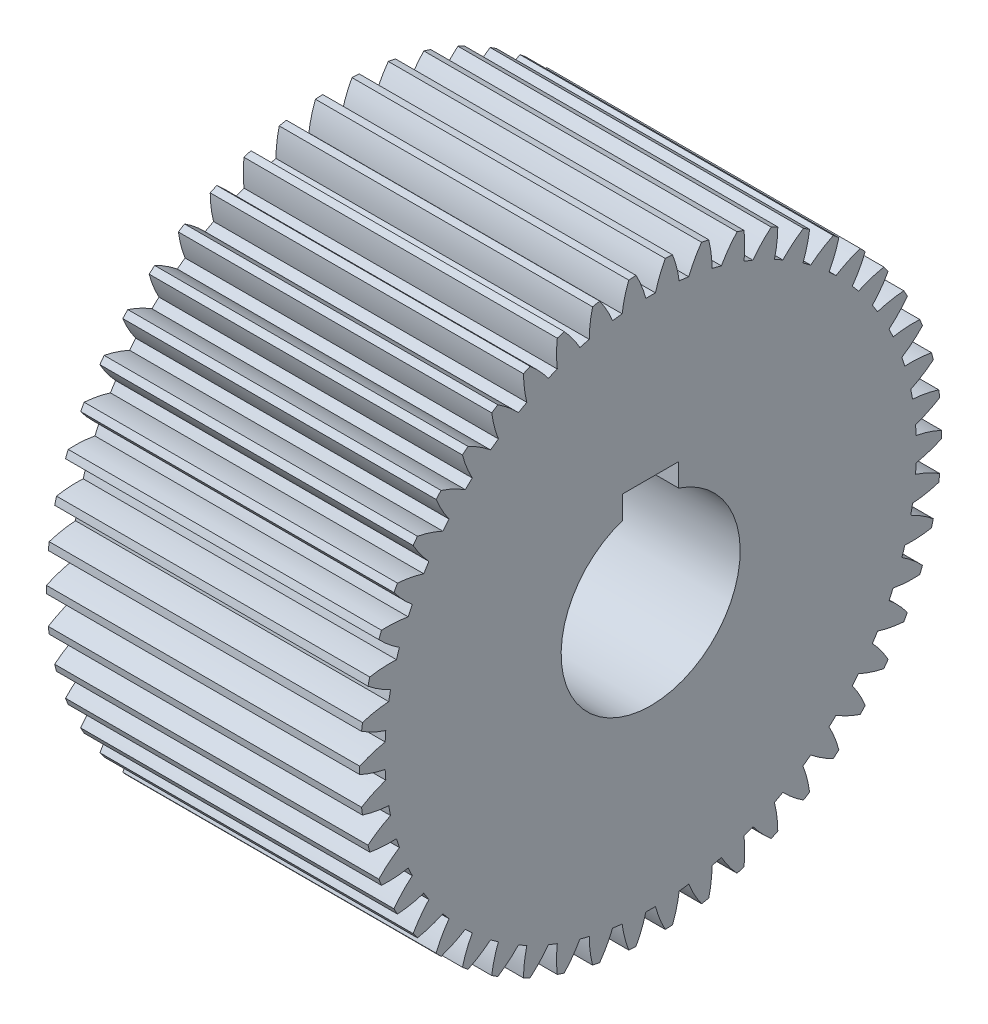
from build123d import *

# Parameters (mm, degrees)
BASPROSKE_W     = 56
BASPROSKE_H     = 52
TOOTHCUT_DEPTH  = 93.433760066
TEETHCUTS_COUNT = 50
TEETHCUTS_ANGLE = 352.8
BORSKE_R        = 16
BORE_DEPTH      = 56.0000508
KEYSKE_W        = 10
KEYSKE_H        = 19.3
KEYWAY_DEPTH    = 56.0000508


with BuildPart() as part:
    # BasProSke → Base-Revolve (revolve)
    with BuildSketch(Plane(origin=(0, 0, 0), x_dir=(1, 0, 0), z_dir=(0, 1, 0)), mode=Mode.PRIVATE) as base_revolve_sk:
        with Locations((28, 26)):
            Rectangle(BASPROSKE_W, BASPROSKE_H)
    revolve(base_revolve_sk.sketch.rotate(Axis((-10, 0, 0), (1, 0, 0)), 180), axis=Axis((-10, 0, 0), (1, 0, 0)))

    # TooCutSke → ToothCut (cut, through all)
    with BuildSketch(Plane(origin=(0, 0, 0), x_dir=(0, 0, -1), z_dir=(1, 0, 0))):
        with BuildLine():
            ThreePointArc((0.86062222, 47.491202663), (0, 47.499), (-0.86062222, 47.491202663))
            ThreePointArc((-0.86062222, 47.491202663), (-1.610166517, 49.778366785), (-2.629027787, 51.958930494))
            ThreePointArc((-2.629027787, 51.958930494), (0, 52.0254), (2.629027787, 51.958930494))
            ThreePointArc((2.629027787, 51.958930494), (1.610166517, 49.778366785), (0.86062222, 47.491202663))
        make_face()
    toothcut = extrude(amount=TOOTHCUT_DEPTH, mode=Mode.SUBTRACT)

    # TeethCuts: ToothCut ×50 about axis
    teethcuts_axis = Axis((-10, 0, 0), (1, 0, 0))
    for i in range(1, TEETHCUTS_COUNT):
        add(toothcut.rotate(teethcuts_axis, i * TEETHCUTS_ANGLE / (TEETHCUTS_COUNT - 1)), mode=Mode.SUBTRACT)

    # BorSke → Bore (cut, symmetric)
    with BuildSketch(Plane(origin=(0, 0, 0), x_dir=(0, 0, -1), z_dir=(1, 0, 0))):
        with Locations(Location((0, 0, 0), (0, 0, 180))):
            Circle(BORSKE_R)
    extrude(amount=BORE_DEPTH, both=True, mode=Mode.SUBTRACT)

    # KeySke → Keyway (cut, symmetric)
    with BuildSketch(Plane(origin=(0, 0, 0), x_dir=(0, 0, -1), z_dir=(1, 0, 0))):
        with Locations((0, 9.65)):
            Rectangle(KEYSKE_W, KEYSKE_H)
    extrude(amount=KEYWAY_DEPTH, both=True, mode=Mode.SUBTRACT)


solid = part.part
